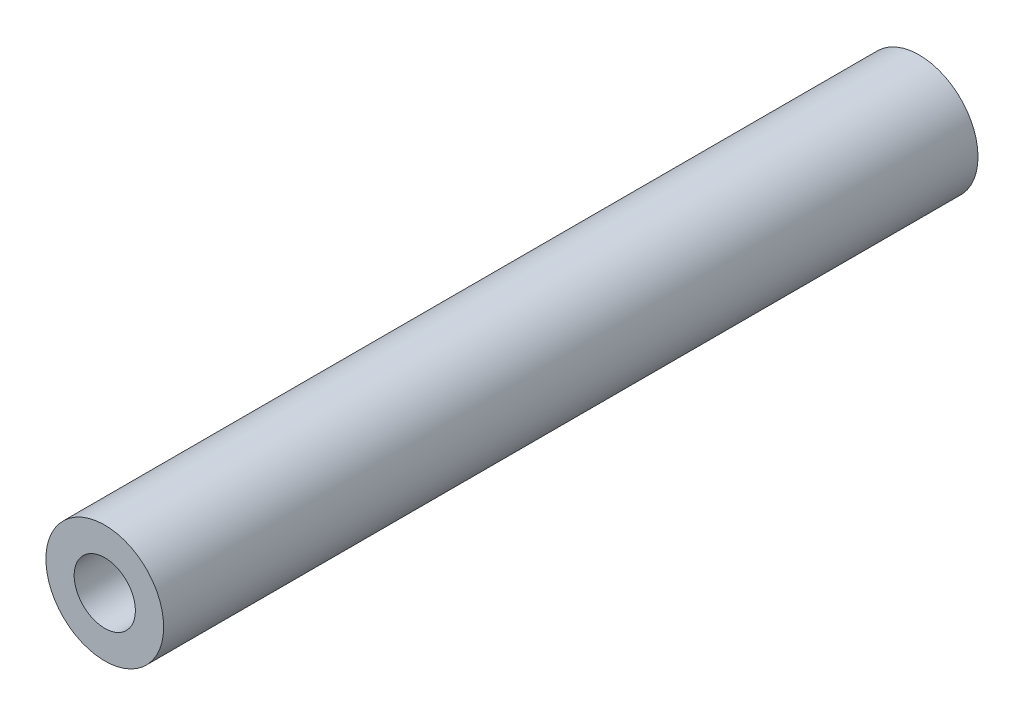
from build123d import *

# Parameters (mm, degrees)
SKETCH1_R      = 1.5875
SKETCH1_R_2    = 0.8255
EXTRUDE1_DEPTH = 21.9577


with BuildPart() as part:
    # Sketch1 → Extrude1 (new body)
    with BuildSketch(Plane.XY):
        Circle(SKETCH1_R)
        Circle(SKETCH1_R_2, mode=Mode.SUBTRACT)
    extrude(amount=EXTRUDE1_DEPTH)


solid = part.part
